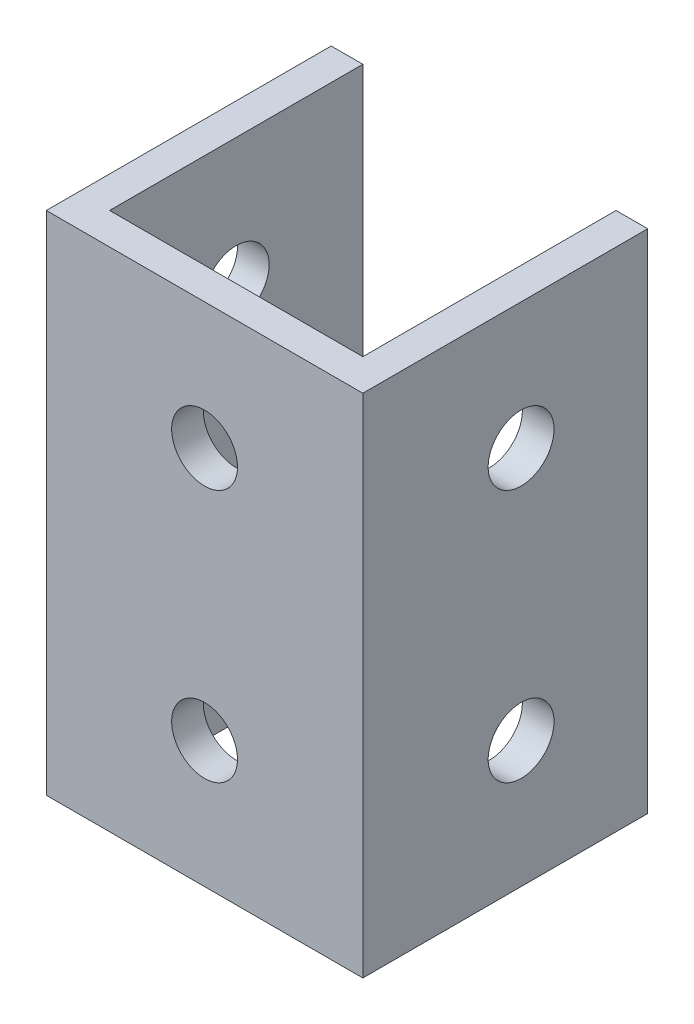
from build123d import *

# Parameters (mm, degrees)
BOSS_EXTRUDE1_DEPTH = 50.8
CUT_EXTRUDE1_REACH  = 68.372
SKETCH2_R           = 3.302
SKETCH3_R           = 3.302
CUT_EXTRUDE2_DEPTH  = 67.371930249


with BuildPart() as part:
    # Sketch1 → Boss-Extrude1 (new body)
    with BuildSketch(Plane(origin=(0, 0, 0), x_dir=(1, 0, 0), z_dir=(0, 1, 0))):
        Polygon((0, 0), (0, -28.575), (31.75, -28.575), (31.75, 0), (28.575, 0), (28.575, -25.4), (3.175, -25.4), (3.175, 0), align=None)
    extrude(amount=BOSS_EXTRUDE1_DEPTH)

    # Sketch2 → Cut-Extrude1 (cut, up to next)
    with BuildSketch(Plane.XY.offset(28.575), mode=Mode.PRIVATE) as cut_extrude1_sk1:
        with Locations((15.875, 38.1)):
            Circle(SKETCH2_R)
    cut_extrude1_tool1 = extrude(cut_extrude1_sk1.sketch, amount=-CUT_EXTRUDE1_REACH, mode=Mode.PRIVATE) & part.part
    # Sketch2 → Cut-Extrude1 (cut, up to next)
    with BuildSketch(Plane.XY.offset(28.575), mode=Mode.PRIVATE) as cut_extrude1_sk2:
        with Locations((15.875, 12.7)):
            Circle(SKETCH2_R)
    cut_extrude1_tool2 = extrude(cut_extrude1_sk2.sketch, amount=-CUT_EXTRUDE1_REACH, mode=Mode.PRIVATE) & part.part
    add(cut_extrude1_tool1.solids().sort_by_distance((15.875, 38.1, 28.575))[0], mode=Mode.SUBTRACT)
    add(cut_extrude1_tool2.solids().sort_by_distance((15.875, 12.7, 28.575))[0], mode=Mode.SUBTRACT)

    # Sketch3 → Cut-Extrude2 (cut, through all)
    with BuildSketch(Plane(origin=(31.75, 0, 0), x_dir=(0, 0, -1), z_dir=(1, 0, 0))):
        with Locations((-12.7, 38.1)):
            Circle(SKETCH3_R)
        with Locations((-12.7, 12.7)):
            Circle(SKETCH3_R)
    extrude(amount=-CUT_EXTRUDE2_DEPTH, mode=Mode.SUBTRACT)


solid = part.part
